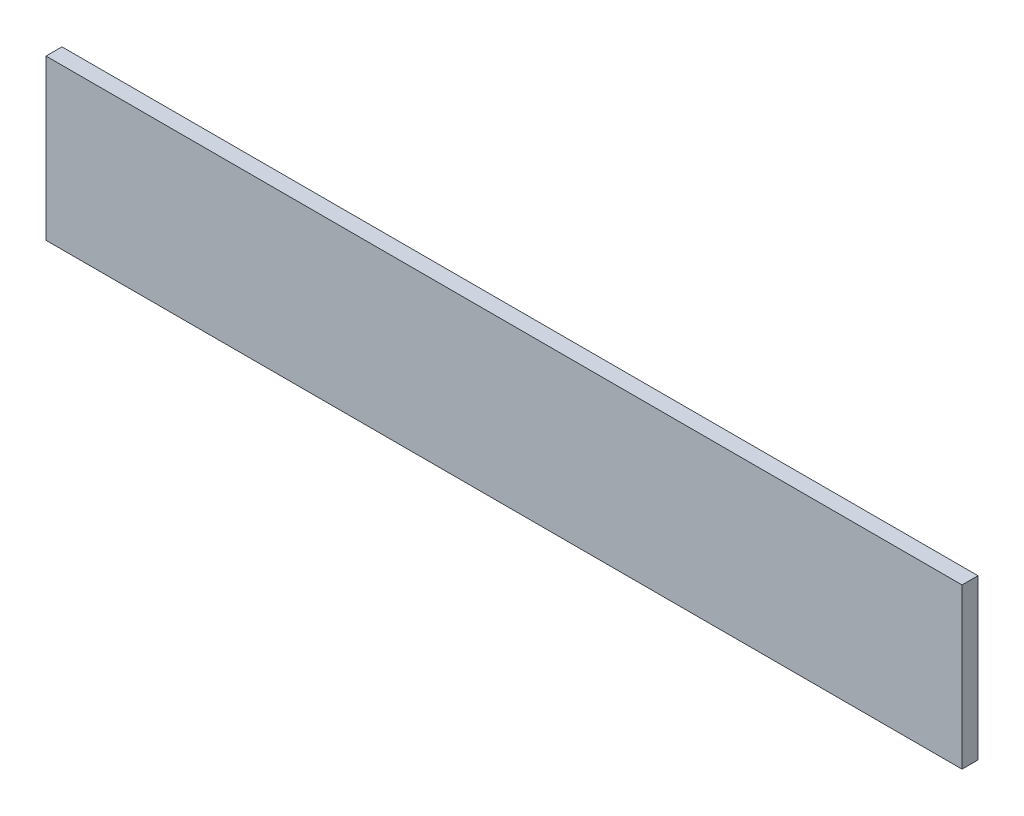
from build123d import *

# Parameters (mm, degrees)
SKETCH1_W           = 574
SKETCH1_H           = 100
BOSS_EXTRUDE1_DEPTH = 10


with BuildPart() as part:
    # Sketch1 → Boss-Extrude1 (new body)
    with BuildSketch(Plane.XY):
        Rectangle(SKETCH1_W, SKETCH1_H)
    extrude(amount=BOSS_EXTRUDE1_DEPTH)


solid = part.part
